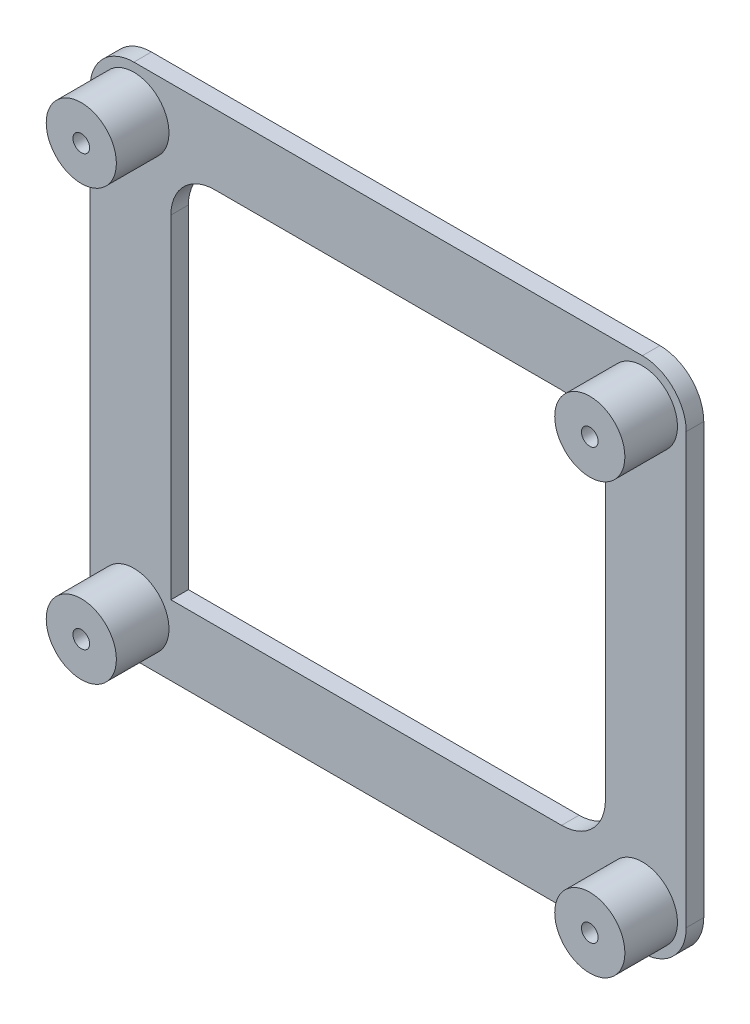
from build123d import *

# Parameters (mm, degrees)
SKETCH1_W           = 68
SKETCH1_H           = 59
SKETCH1_R           = 0.95
SKETCH1_W_2         = 49.559322034
SKETCH1_H_2         = 43
BOSS_EXTRUDE1_DEPTH = 2
SKETCH2_R           = 4
SKETCH2_R_2         = 0.95
BOSS_EXTRUDE2_DEPTH = 6
FILLET1_R           = 5


with BuildPart() as part:
    # Sketch1 → Boss-Extrude1 (new body)
    with BuildSketch(Plane.XY):
        Rectangle(SKETCH1_W, SKETCH1_H)
        with Locations((-29, 24.5)):
            Circle(SKETCH1_R, mode=Mode.SUBTRACT)
        with Locations((29, 24.5)):
            Circle(SKETCH1_R, mode=Mode.SUBTRACT)
        with Locations((29, -24.5)):
            Circle(SKETCH1_R, mode=Mode.SUBTRACT)
        with Locations((-29, -24.5)):
            Circle(SKETCH1_R, mode=Mode.SUBTRACT)
        Rectangle(SKETCH1_W_2, SKETCH1_H_2, mode=Mode.SUBTRACT)
    extrude(amount=BOSS_EXTRUDE1_DEPTH)

    # Sketch2 → Boss-Extrude2 (add)
    # profile 1 of 4: a face of its own
    with BuildSketch(Plane.XY.offset(2)):
        with Locations(Location((-29, 24.5, 0), (0, 0, 180))):
            Circle(SKETCH2_R)
        with Locations((-29, 24.5)):
            Circle(SKETCH2_R_2, mode=Mode.SUBTRACT)
    # profile 2 of 4: a face of its own
    with BuildSketch(Plane.XY.offset(2)):
        with Locations(Location((29, 24.5, 0), (0, 0, 180))):
            Circle(SKETCH2_R)
        with Locations((29, 24.5)):
            Circle(SKETCH2_R_2, mode=Mode.SUBTRACT)
    # profile 3 of 4: a face of its own
    with BuildSketch(Plane.XY.offset(2)):
        with Locations(Location((29, -24.5, 0), (0, 0, 180))):
            Circle(SKETCH2_R)
        with Locations((29, -24.5)):
            Circle(SKETCH2_R_2, mode=Mode.SUBTRACT)
    # profile 4 of 4: a face of its own
    with BuildSketch(Plane.XY.offset(2)):
        with Locations(Location((-29, -24.5, 0), (0, 0, 180))):
            Circle(SKETCH2_R)
        with Locations((-29, -24.5)):
            Circle(SKETCH2_R_2, mode=Mode.SUBTRACT)
    extrude(amount=BOSS_EXTRUDE2_DEPTH)

    # Fillet1
    fillet1_edges = [part.edges().sort_by_distance(p)[0] for p in [
        (24.779661017, -21.5, 1),
        (24.779661017, 21.5, 1),
        (-24.779661017, 21.5, 1),
        (34, -29.5, 1),
        (-34, -29.5, 1),
        (-34, 29.5, 1),
        (34, 29.5, 1),
    ]]
    fillet(fillet1_edges, radius=FILLET1_R)


solid = part.part
